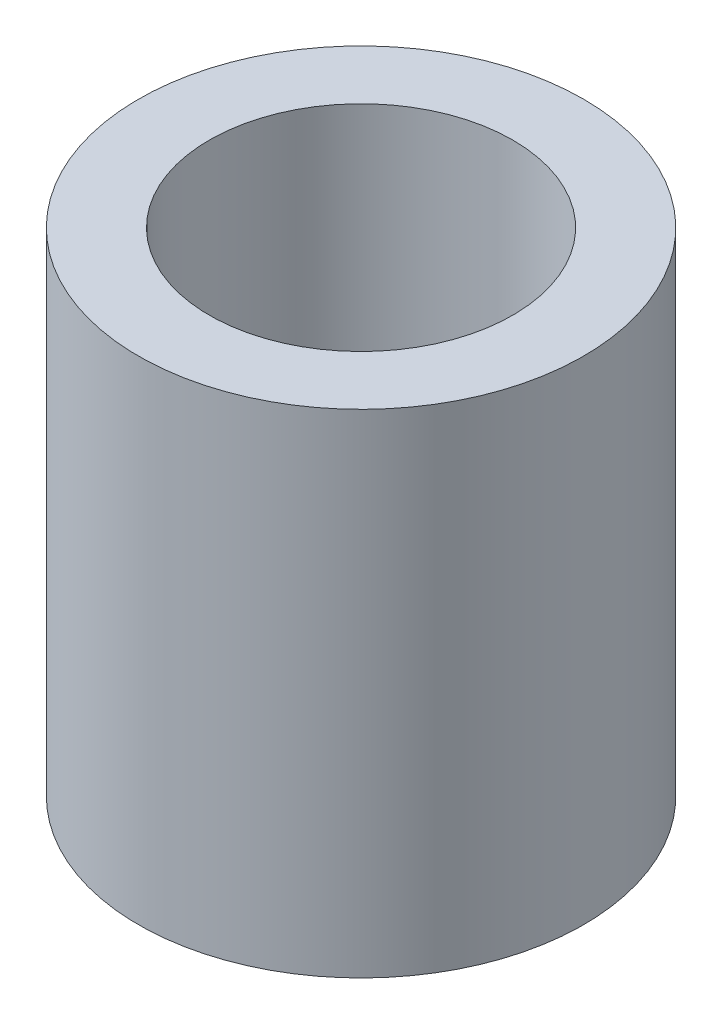
from build123d import *

# Parameters (mm, degrees)
SKETCH1_W = 2.1
SKETCH1_H = 14.605


with BuildPart() as part:
    # Sketch1 → Revolve1 (revolve)
    with BuildSketch(Plane.XY, mode=Mode.PRIVATE) as revolve1_sk:
        with Locations((-5.55, 7.3025)):
            Rectangle(SKETCH1_W, SKETCH1_H)
    revolve(revolve1_sk.sketch.rotate(Axis((0, 0, 0), (0, 1, 0)), 270), axis=Axis((0, 0, 0), (0, 1, 0)))


solid = part.part
